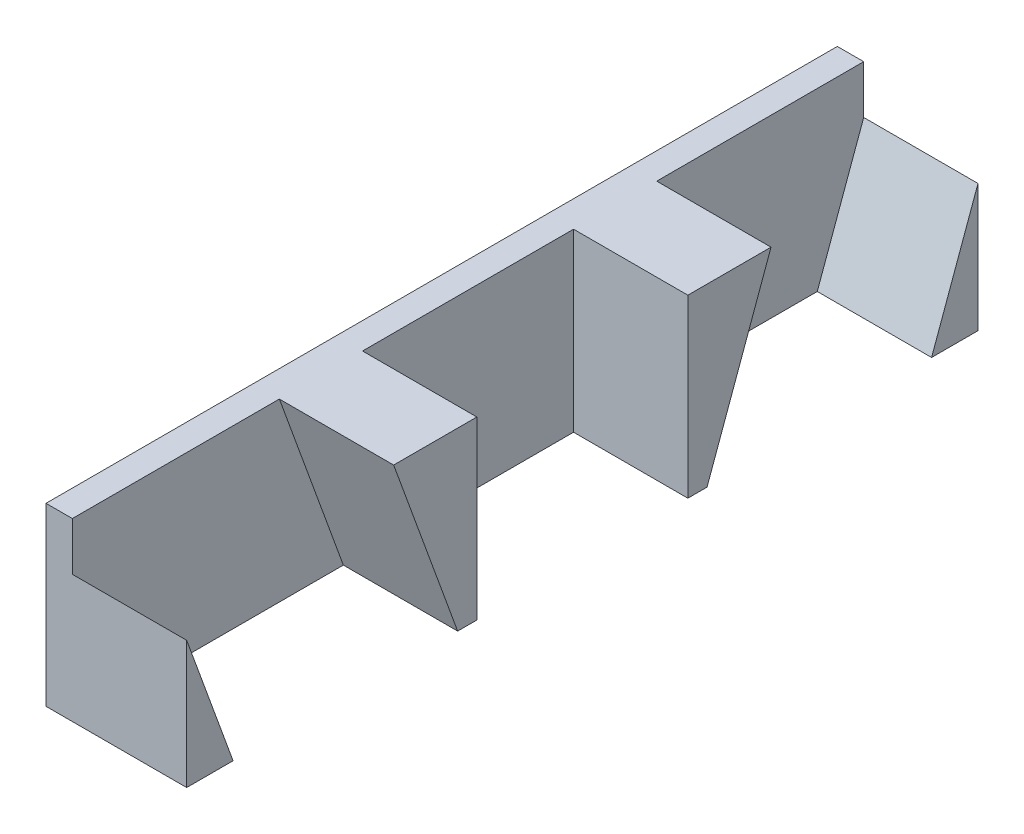
from build123d import *

# Parameters (mm, degrees)
SALIENTE_EXTRUIR1_DEPTH = 49
CORTAR_EXTRUIR1_DEPTH   = 70.738798384
SALIENTE_EXTRUIR3_DEPTH = 10
CROQUIS8_W              = 12
CROQUIS8_H              = 10
CORTAR_EXTRUIR2_DEPTH   = 6.5
CROQUIS9_W              = 20
CROQUIS9_H              = 12
SALIENTE_EXTRUIR4_DEPTH = 1.5
CROQUIS10_W             = 49
CROQUIS10_H             = 45
CORTAR_EXTRUIR6_DEPTH   = 16
CROQUIS13_W             = 2
CROQUIS13_H             = 10
CORTAR_EXTRUIR7_DEPTH   = 64.131209746


with BuildPart() as part:
    # Croquis1 → Saliente-Extruir1 (new body)
    with BuildSketch(Plane.XY):
        Polygon((-3.5, 49.5), (-3.5, 0), (0, 0), (0, 41.994225778), align=None)
    extrude(amount=SALIENTE_EXTRUIR1_DEPTH)

    # Croquis2 → Cortar-Extruir1 (cut, through all)
    with BuildSketch(Plane(origin=(0, 0, 0), x_dir=(0, 0, -1), z_dir=(1, 0, 0))):
        Polygon((-49, 0), (0, 0), (0, 28.994225778), (-14.5, 28.994225778), (-14.5, 4.5), (-34.5, 4.5), (-34.5, 28.994225778), (-49, 28.994225778), align=None)
    extrude(amount=-CORTAR_EXTRUIR1_DEPTH, mode=Mode.SUBTRACT)

    # Croquis4 → Saliente-Extruir3 (add)
    with BuildSketch(Plane.XZ.offset(-28.994225778)):
        Polygon((0, 49), (20.5, 49), (20.5, 0), (0, 0), (0, 1.5), (12.5, 1.5), (12.5, 47.5), (0, 47.5), align=None)
    extrude(amount=-SALIENTE_EXTRUIR3_DEPTH)

    # Croquis8 → Cortar-Extruir2 (cut)
    with BuildSketch(Plane(origin=(20.5, 0, 0), x_dir=(0, 0, -1), z_dir=(1, 0, 0))):
        with Locations((-24.5, 33.994225778)):
            Rectangle(CROQUIS8_W, CROQUIS8_H)
        Polygon((-48, 38.994225778), (-44.360297657, 28.994225778), (-31.590164388, 28.994225778), (-35.22986673, 38.994225778), align=None)
        Polygon((-17.409835612, 28.994225778), (-4.639702343, 28.994225778), (-1, 38.994225778), (-13.77013327, 38.994225778), align=None)
    extrude(amount=-CORTAR_EXTRUIR2_DEPTH, mode=Mode.SUBTRACT)

    # Croquis9 → Saliente-Extruir4 (add)
    with BuildSketch(Plane(origin=(0, 0, 0), x_dir=(0, 0, -1), z_dir=(1, 0, 0))):
        with Locations((-24.5, 10.5)):
            Rectangle(CROQUIS9_W, CROQUIS9_H)
    extrude(amount=SALIENTE_EXTRUIR4_DEPTH)

    # Croquis10 → Cortar-Extruir6 (cut)
    with BuildSketch(Plane.ZY.offset(3.5)):
        with Locations((24.5, 27)):
            Rectangle(CROQUIS10_W, CROQUIS10_H)
    extrude(amount=-CORTAR_EXTRUIR6_DEPTH, mode=Mode.SUBTRACT)

    # Croquis13 → Cortar-Extruir7 (cut, through all)
    with BuildSketch(Plane(origin=(20.5, 0, 0), x_dir=(0, 0, -1), z_dir=(1, 0, 0))):
        with Locations((-48, 33.994225778)):
            Rectangle(CROQUIS13_W, CROQUIS13_H)
        with Locations((-1, 33.994225778)):
            Rectangle(CROQUIS13_W, CROQUIS13_H)
    extrude(amount=-CORTAR_EXTRUIR7_DEPTH, mode=Mode.SUBTRACT)


solid = part.part
